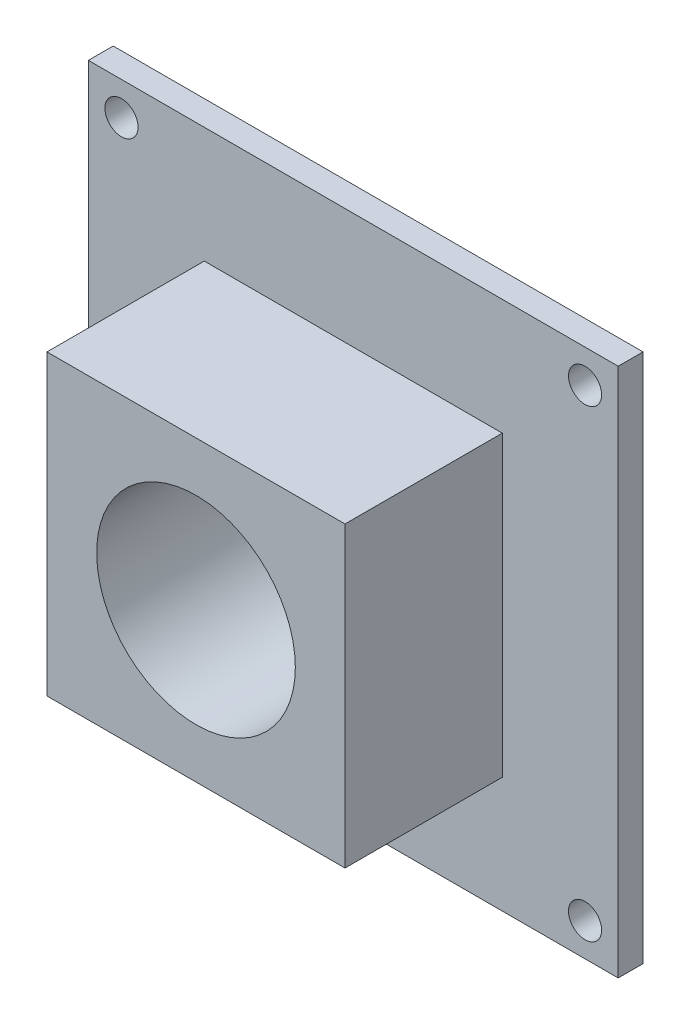
from build123d import *

# Parameters (mm, degrees)
SKETCH_1_W      = 32
SKETCH_1_H      = 32
SKETCH_1_R      = 1
EXTRUDE_1_DEPTH = 1.5
SKETCH_2_W      = 18
SKETCH_2_H      = 18
SKETCH_2_R      = 6
EXTRUDE_2_DEPTH = 9.5


with BuildPart() as part:
    # ｽｹｯﾁ1 → ﾎﾞｽ - 押し出し1 (new body)
    with BuildSketch(Plane.XY):
        Rectangle(SKETCH_1_W, SKETCH_1_H)
        with Locations((-14, 14)):
            Circle(SKETCH_1_R, mode=Mode.SUBTRACT)
        with Locations((14, 14)):
            Circle(SKETCH_1_R, mode=Mode.SUBTRACT)
        with Locations((14, -14)):
            Circle(SKETCH_1_R, mode=Mode.SUBTRACT)
        with Locations((-14, -14)):
            Circle(SKETCH_1_R, mode=Mode.SUBTRACT)
    extrude(amount=EXTRUDE_1_DEPTH)

    # ｽｹｯﾁ2 → ﾎﾞｽ - 押し出し2 (add)
    with BuildSketch(Plane.XY.offset(1.5)):
        Rectangle(SKETCH_2_W, SKETCH_2_H)
        Circle(SKETCH_2_R, mode=Mode.SUBTRACT)
    extrude(amount=EXTRUDE_2_DEPTH)


solid = part.part
